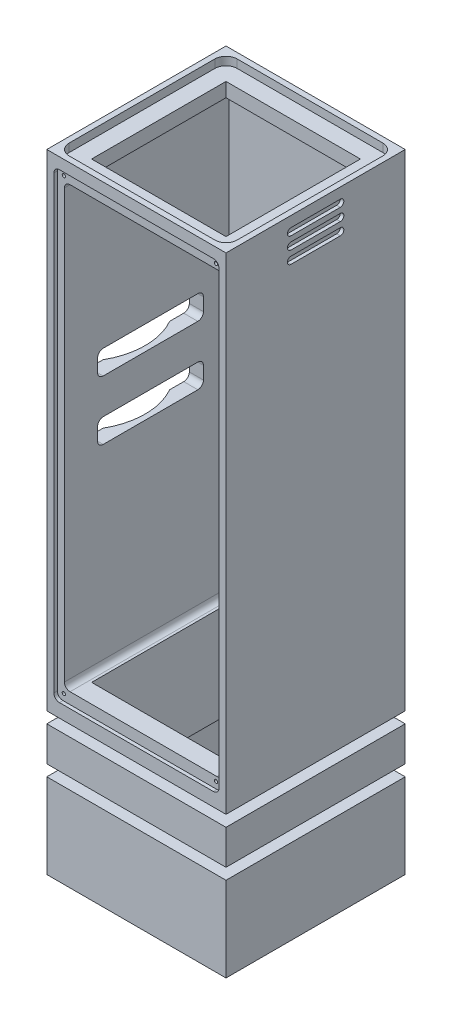
from build123d import *

# Parameters (mm, degrees)
SKETCH1_W                    = 50.8
SKETCH1_H                    = 50.8
SKETCH1_W_2                  = 38.1
SKETCH1_H_2                  = 38.1
BOSS_EXTRUDE1_DEPTH          = 178
SKETCH2_W                    = 44.8
SKETCH2_H                    = 44.8
SKETCH2_W_2                  = 38.1
SKETCH2_H_2                  = 38.1
CUT_EXTRUDE1_DEPTH           = 20
SKETCH3_W                    = 46.8
SKETCH3_H                    = 124.475000116
CUT_EXTRUDE2_DEPTH           = 47.625
SKETCH4_W                    = 50.8
SKETCH4_H                    = 3.175
CUT_EXTRUDE3_DEPTH           = 3.175
SKETCH5_W                    = 3.175
SKETCH5_H                    = 3.175
CUT_EXTRUDE4_DEPTH           = 192.951243809
CUT_EXTRUDE5_DEPTH           = 1
SKETCH7_W                    = 46.8
SKETCH7_H                    = 3.175
CUT_EXTRUDE6_DEPTH           = 1
FILLET1_R                    = 1.5875
CUT_EXTRUDE7_DEPTH           = 2.34442
M1_2X0_25_TAPPED_HOLE1_D     = 0.95
M1_2X0_25_TAPPED_HOLE1_DEPTH = 2.9997
M1_2X0_25_TAPPED_HOLE1_TIP   = 0.285408794
BOSS_EXTRUDE2_REACH          = 193.689
CUT_EXTRUDE8_REACH           = 193.951
SKETCH15_W                   = 30
SKETCH15_H                   = 6.8
FILLET2_R                    = 1.5875
CUT_EXTRUDE9_DEPTH           = 21.8
CUT_EXTRUDE9_DEPTH_BACK      = 21.8
SKETCH20_R                   = 19.05


with BuildPart() as part:
    # Sketch1 → Boss-Extrude1 (new body)
    with BuildSketch(Plane(origin=(0, 0, 0), x_dir=(1, 0, 0), z_dir=(0, 1, 0))):
        with Locations((25.4, 25.4)):
            Rectangle(SKETCH1_W, SKETCH1_H)
        with Locations((25.4, 25.4)):
            Rectangle(SKETCH1_W_2, SKETCH1_H_2, mode=Mode.SUBTRACT)
    extrude(amount=BOSS_EXTRUDE1_DEPTH)

    # Sketch2 → Cut-Extrude1 (cut)
    with BuildSketch(Plane.XZ):
        with Locations((25.4, -25.4)):
            Rectangle(SKETCH2_W, SKETCH2_H)
        with Locations((25.4, -25.4)):
            Rectangle(SKETCH2_W_2, SKETCH2_H_2, mode=Mode.SUBTRACT)
    extrude(amount=-CUT_EXTRUDE1_DEPTH, mode=Mode.SUBTRACT)

    # Sketch3 → Cut-Extrude2 (cut)
    with BuildSketch(Plane.XY):
        with Locations((25.4, 109.412499942)):
            Rectangle(SKETCH3_W, SKETCH3_H)
    extrude(amount=-CUT_EXTRUDE2_DEPTH, mode=Mode.SUBTRACT)

    # Sketch4 → Cut-Extrude3 (cut)
    with BuildSketch(Plane.XY):
        with Locations((25.4, 25.5875)):
            Rectangle(SKETCH4_W, SKETCH4_H)
        with Locations((25.4, 38.5875)):
            Rectangle(SKETCH4_W, SKETCH4_H)
    cut_extrude3 = extrude(amount=-CUT_EXTRUDE3_DEPTH, mode=Mode.SUBTRACT)

    # Sketch5 → Cut-Extrude4 (cut, through all)
    with BuildSketch(Plane.XY):
        with Locations((1.5875, 38.5875)):
            Rectangle(SKETCH5_W, SKETCH5_H)
        with Locations((1.5875, 25.5875)):
            Rectangle(SKETCH5_W, SKETCH5_H)
    cut_extrude4 = extrude(amount=-CUT_EXTRUDE4_DEPTH, mode=Mode.SUBTRACT)

    # Sketch6 → Cut-Extrude5 (cut)
    with BuildSketch(Plane.ZY):
        with BuildLine():
            Line((-32.4, 175), (-18.4, 175))
            ThreePointArc((-18.4, 175), (-17.4, 174), (-18.4, 173))
            Line((-18.4, 173), (-32.4, 173))
            ThreePointArc((-32.4, 173), (-33.4, 174), (-32.4, 175))
        make_face()
        with BuildLine():
            Line((-32.4, 171.5), (-18.4, 171.5))
            ThreePointArc((-18.4, 171.5), (-17.4, 170.5), (-18.4, 169.5))
            Line((-18.4, 169.5), (-32.4, 169.5))
            ThreePointArc((-32.4, 169.5), (-33.4, 170.5), (-32.4, 171.5))
        make_face()
        with BuildLine():
            Line((-32.4, 168), (-18.4, 168))
            ThreePointArc((-18.4, 168), (-17.4, 167), (-18.4, 166))
            Line((-18.4, 166), (-32.4, 166))
            ThreePointArc((-32.4, 166), (-33.4, 167), (-32.4, 168))
        make_face()
    cut_extrude5 = extrude(amount=-CUT_EXTRUDE5_DEPTH, mode=Mode.SUBTRACT)

    # Mirror1: Cut-Extrude3 across plane
    add(cut_extrude3.mirror(Plane.XY.offset(-25.4)), mode=Mode.SUBTRACT)

    # Mirror2: Cut-Extrude4, Cut-Extrude5 across plane
    add(cut_extrude4.mirror(Plane.ZY.offset(-25.4)), mode=Mode.SUBTRACT)
    add(cut_extrude5.mirror(Plane.ZY.offset(-25.4)), mode=Mode.SUBTRACT)

    # Sketch7 → Cut-Extrude6 (cut)
    with BuildSketch(Plane.XY):
        with Locations((25.4, 173.2375)):
            Rectangle(SKETCH7_W, SKETCH7_H)
        with Locations((25.4, 45.587499884)):
            Rectangle(SKETCH7_W, SKETCH7_H)
    extrude(amount=-CUT_EXTRUDE6_DEPTH, mode=Mode.SUBTRACT)

    # Fillet1
    fillet1_edges = [part.edges().sort_by_distance(p)[0] for p in [
        (47.8, 10, -3),
        (47.8, 10, -47.8),
        (2, 174.825, -0.5),
        (48.8, 174.825, -0.5),
        (3, 10, -47.8),
        (2, 43.999999884, -0.5),
        (3, 10, -3),
        (48.8, 43.999999884, -0.5),
        (2, 47.174999884, -24.3125),
        (2, 171.65, -24.3125),
        (48.8, 171.65, -24.3125),
        (48.8, 47.174999884, -24.3125),
    ]]
    fillet(fillet1_edges, radius=FILLET1_R)

    # Sketch8 → Cut-Extrude7 (cut)
    with BuildSketch(Plane(origin=(0, 178, 0), x_dir=(1, 0, 0), z_dir=(0, 1, 0))):
        with BuildLine():
            Line((4.7625, 49.2125), (46.0375, 49.2125))
            ThreePointArc((46.0375, 49.2125), (48.28256403, 48.28256403), (49.2125, 46.0375))
            Line((49.2125, 46.0375), (49.2125, 4.7625))
            ThreePointArc((49.2125, 4.7625), (48.28256403, 2.51743597), (46.0375, 1.5875))
            Line((46.0375, 1.5875), (4.7625, 1.5875))
            ThreePointArc((4.7625, 1.5875), (2.51743597, 2.51743597), (1.5875, 4.7625))
            Line((1.5875, 4.7625), (1.5875, 46.0375))
            ThreePointArc((1.5875, 46.0375), (2.51743597, 48.28256403), (4.7625, 49.2125))
        make_face()
    extrude(amount=-CUT_EXTRUDE7_DEPTH, mode=Mode.SUBTRACT)

    # M1.2x0.25 Tapped Hole1
    with Locations(Plane.XY.offset(-1)):
        with Locations((3.8415, 172.98375321), (46.95875321, 172.98375321), (3.8415, 45.841499884), (46.95875321, 45.841499884)):
            Hole(M1_2X0_25_TAPPED_HOLE1_D / 2, depth=M1_2X0_25_TAPPED_HOLE1_DEPTH)
            with Locations((0, 0, -(M1_2X0_25_TAPPED_HOLE1_DEPTH + M1_2X0_25_TAPPED_HOLE1_TIP / 2))):  # 118° drill point
                Cone(0, M1_2X0_25_TAPPED_HOLE1_D / 2, M1_2X0_25_TAPPED_HOLE1_TIP, mode=Mode.SUBTRACT)

    # Sketch17 → Boss-Extrude2 (add, up to next)
    with BuildSketch(Plane.XY.offset(-1), mode=Mode.PRIVATE) as boss_extrude2_sk1:
        with BuildLine():
            Line((2, 170.0625), (2, 48.762499884))
            ThreePointArc((2, 48.762499884), (2.464967985, 47.639967869), (3.5875, 47.174999884))
            Line((3.5875, 47.174999884), (5.5875, 47.174999884))
            ThreePointArc((5.5875, 47.174999884), (4.464967985, 47.639967869), (4, 48.762499884))
            Line((4, 48.762499884), (4, 170.0625))
            ThreePointArc((4, 170.0625), (4.464967985, 171.185032015), (5.5875, 171.65))
            Line((5.5875, 171.65), (3.5875, 171.65))
            ThreePointArc((3.5875, 171.65), (2.464967985, 171.185032015), (2, 170.0625))
        make_face()
    boss_extrude2_tool1 = extrude(boss_extrude2_sk1.sketch, amount=-BOSS_EXTRUDE2_REACH, mode=Mode.PRIVATE) - part.part
    add(boss_extrude2_tool1.solids().sort_by_distance((3.00869, 109.4125, -1))[0])

    # Sketch15 → Cut-Extrude8 (cut, up to next)
    with BuildSketch(Plane.ZY, mode=Mode.PRIVATE) as cut_extrude8_sk1:
        with Locations((-25.4, 105)):
            Rectangle(SKETCH15_W, SKETCH15_H)
    cut_extrude8_tool1 = extrude(cut_extrude8_sk1.sketch, amount=-CUT_EXTRUDE8_REACH, mode=Mode.PRIVATE) & part.part
    # Sketch15 → Cut-Extrude8 (cut, up to next)
    with BuildSketch(Plane.ZY, mode=Mode.PRIVATE) as cut_extrude8_sk2:
        with Locations((-25.4, 121.8)):
            Rectangle(SKETCH15_W, SKETCH15_H)
    cut_extrude8_tool2 = extrude(cut_extrude8_sk2.sketch, amount=-CUT_EXTRUDE8_REACH, mode=Mode.PRIVATE) & part.part
    add(cut_extrude8_tool1.solids().sort_by_distance((0, 105, -25.4))[0], mode=Mode.SUBTRACT)
    add(cut_extrude8_tool2.solids().sort_by_distance((0, 121.8, -25.4))[0], mode=Mode.SUBTRACT)

    # Fillet2
    fillet2_edges = [part.edges().sort_by_distance(p)[0] for p in [
        (2, 101.6, -10.4),
        (2, 108.4, -10.4),
        (2, 108.4, -40.4),
        (2, 101.6, -40.4),
        (2, 118.4, -10.4),
        (2, 125.2, -10.4),
        (2, 125.2, -40.4),
        (2, 118.4, -40.4),
    ]]
    fillet(fillet2_edges, radius=FILLET2_R)

    # Sketch20 → Cut-Extrude9 (cut, two sides: drawn at the far end of the back side and taken through both)
    with BuildSketch(Plane(origin=(0, 113.4, 0), x_dir=(1, 0, 0), z_dir=(0, 1, 0)).offset(-CUT_EXTRUDE9_DEPTH_BACK)):
        with Locations((-16.55, 25.4)):
            Circle(SKETCH20_R)
    extrude(amount=CUT_EXTRUDE9_DEPTH + CUT_EXTRUDE9_DEPTH_BACK, mode=Mode.SUBTRACT)


solid = part.part
